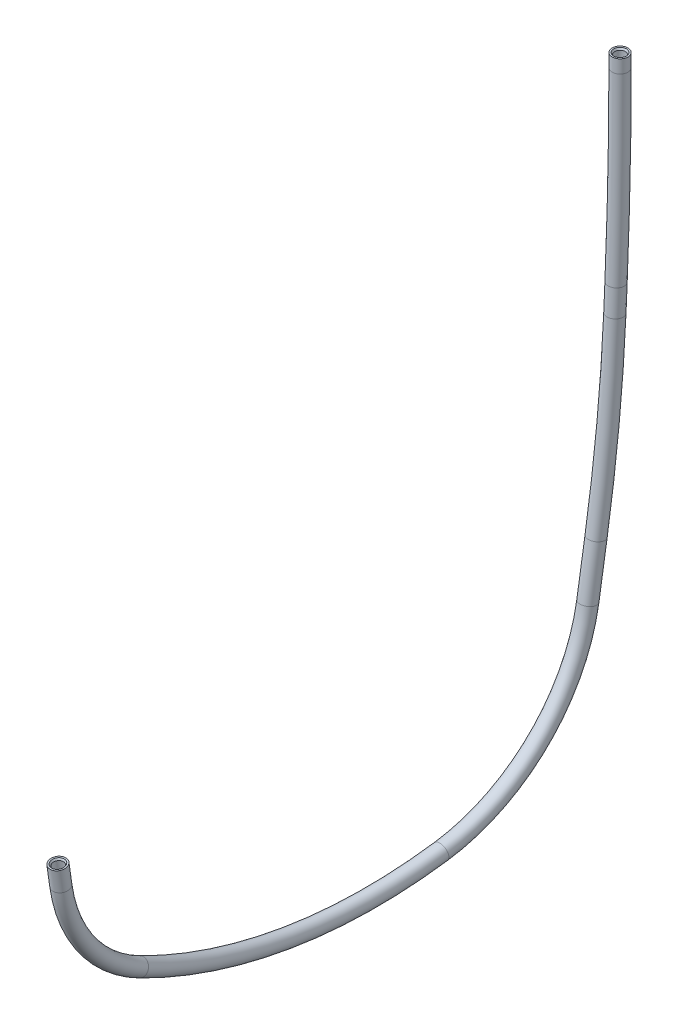
from build123d import *
from OCP.BRepFilletAPI import BRepFilletAPI_MakeChamfer

# Parameters (mm, degrees)
PERFIL_BOWDEN_R   = 3
PERFIL_BOWDEN_R_2 = 2
CHAFL_N2_SIZE     = 0.4
CHAFL_N2_SIZE2    = 0.692820323


with BuildPart() as part:
    # Barrer1: sweep along a curve in space
    with BuildLine() as barrer1_path:
        Line((-179.55, 237.9, 23.45), (-179.55, 232.9, 23.45))
        ThreePointArc((-179.55, 232.9, 23.45), (-179.55, 197.994333352, 23.830077258), (-179.55, 163.105218927, 24.970128802))
        ThreePointArc((-179.55, 163.105218927, 24.970128802), (-179.55, 158.110113707, 25.191344172), (-179.55, 153.115325109, 25.419596817))
        ThreePointArc((-179.55, 153.115325109, 25.419596817), (-179.55, 117.985550969, 28.025652191), (-179.55, 83.053766812, 32.571310699))
        Line((-179.55, 78.115325109, 33.353483024), (-179.55, 83.053766812, 32.571310699))
        Line((-179.55, 78.115325109, 33.353483024), (-179.55, 63.3, 35.7))
        ThreePointArc((-179.55, 63.3, 35.7), (-179.431411326, 26.758540491, 54.415674643), (-179.12153359, 8.351916444, 91.11266322))
        ThreePointArc((-179.12153359, 8.351916444, 91.11266322), (-178.587827908, 8.648566253, 149.248196445), (-178.054412898, 26.525914631, 204.567532573))
        ThreePointArc((-177.721385977, 68.000031071, 234.303977662), (-177.846418952, 43.604990817, 224.537163783), (-178.054412898, 26.525914631, 204.567532573))
        Line((-177.7, 75.8, 235.4), (-177.721385977, 68.000031071, 234.303977662))
    # Perfil bowden → Barrer1 (sweep)
    with BuildSketch(Plane(origin=(-179.55, 237.9, 23.45), x_dir=(-1, 0, 0), z_dir=(0, -1, 0))):
        Circle(PERFIL_BOWDEN_R)
        Circle(PERFIL_BOWDEN_R_2, mode=Mode.SUBTRACT)
    sweep(path=barrer1_path.line)

    # Chaflán2: one chamfer whose edges measure the first distance from different faces: ONE call of the kernel's chamfer builder (chamfer() names one face for all edges)
    chafl_n2_edges_1 = [part.edges().sort_by_distance(p)[0] for p in [
        (-175.700337449, 75.799679414, 235.363263359),
    ]]
    chafl_n2_side_1 = [part.faces().sort_by_distance(p)[0] for p in [
        (-174.785344671, 75.799532723, 235.346453642),
    ]]
    chafl_n2_edges_2 = [part.edges().sort_by_distance(p)[0] for p in [
        (-177.55, 237.9, 23.45),
    ]]
    chafl_n2_side_2 = [part.faces().sort_by_distance(p)[0] for p in [
        (-176.634852814, 237.9, 23.45),
    ]]
    chafl_n2 = BRepFilletAPI_MakeChamfer(part.part.solid().wrapped)
    for e in chafl_n2_edges_1:
        chafl_n2.Add(CHAFL_N2_SIZE, CHAFL_N2_SIZE2, e.wrapped, chafl_n2_side_1[0].wrapped)  # the first distance lies on this face
    for e in chafl_n2_edges_2:
        chafl_n2.Add(CHAFL_N2_SIZE, CHAFL_N2_SIZE2, e.wrapped, chafl_n2_side_2[0].wrapped)  # the first distance lies on this face
    add(Compound.cast(chafl_n2.Shape()), mode=Mode.REPLACE)


with BuildPart() as body_2:
    # Simetría2: mirrored copy
    add(part.part.mirror(Plane(origin=(0, 0, 0), x_dir=(0, 0, 1), z_dir=(1, 0, 0))))


solid = body_2.part
